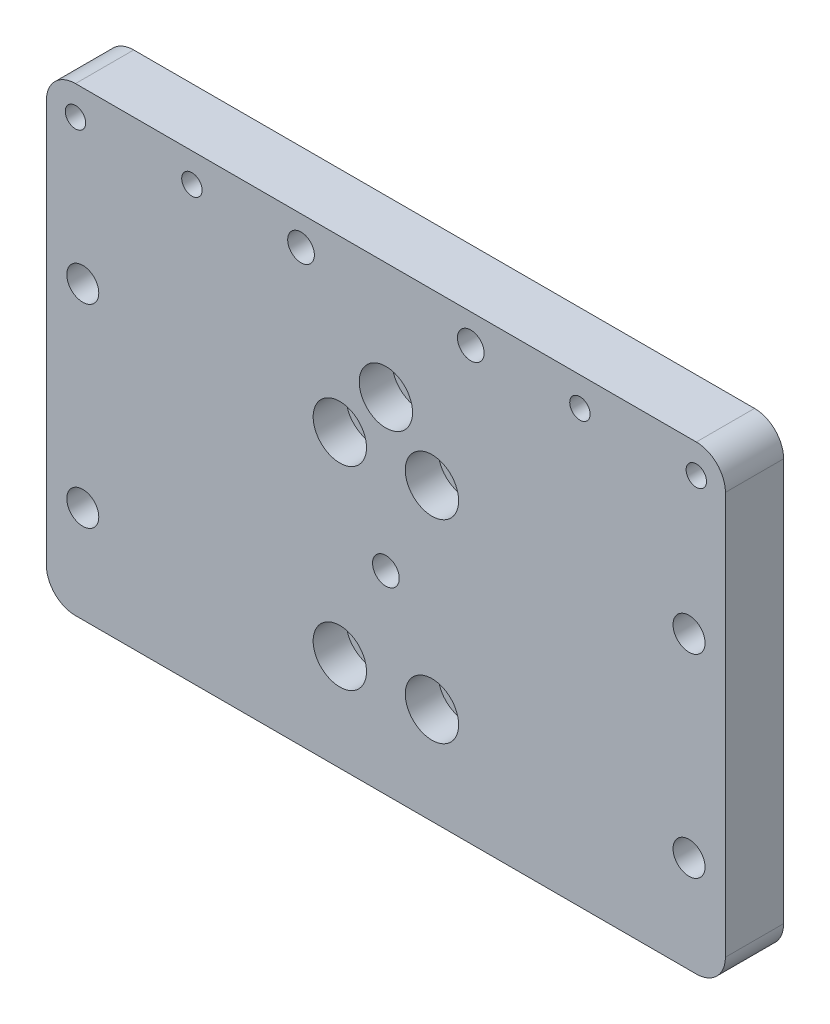
from build123d import *

# Parameters (mm, degrees)
SKETCH1_W           = 140
SKETCH1_H           = 95
BOSS_EXTRUDE1_DEPTH = 6
SKETCH2_R           = 2.75
SKETCH2_R_2         = 3.3
SKETCH2_R_3         = 2.1
CUT_EXTRUDE1_DEPTH  = 86.441500455
SKETCH3_R           = 5.5
CUT_EXTRUDE2_DEPTH  = 6.8
FILLET1_R           = 6


with BuildPart() as part:
    # Sketch1 → Boss-Extrude1 (new, symmetric)
    with BuildSketch(Plane.XY):
        Rectangle(SKETCH1_W, SKETCH1_H)
    extrude(amount=BOSS_EXTRUDE1_DEPTH, both=True)

    # Sketch2 → Cut-Extrude1 (cut, through all)
    with BuildSketch(Plane.XY.offset(6)):
        with Locations((0, 23.5)):
            Circle(SKETCH2_R)
        with Locations((0, -7.5)):
            Circle(SKETCH2_R)
        with Locations((-9.5, 12.5)):
            Circle(SKETCH2_R_2)
        with Locations((-9.5, -27.5)):
            Circle(SKETCH2_R_2)
        with Locations((-17.5, 41.5)):
            Circle(SKETCH2_R)
        with Locations((-40, 41.5)):
            Circle(SKETCH2_R_3)
        with Locations((-64, 41.5)):
            Circle(SKETCH2_R_3)
        with Locations((-62.5, 12.5)):
            Circle(SKETCH2_R_2)
        with Locations((-62.5, -27.5)):
            Circle(SKETCH2_R_2)
        with Locations(Location((62.5, -27.5, 0), (0, 0, 180))):
            Circle(SKETCH2_R_2)
        with Locations(Location((62.5, 12.5, 0), (0, 0, 180))):
            Circle(SKETCH2_R_2)
        with Locations(Location((64, 41.5, 0), (0, 0, 180))):
            Circle(SKETCH2_R_3)
        with Locations(Location((40, 41.5, 0), (0, 0, 180))):
            Circle(SKETCH2_R_3)
        with Locations(Location((17.5, 41.5, 0), (0, 0, 180))):
            Circle(SKETCH2_R)
        with Locations(Location((9.5, -27.5, 0), (0, 0, 180))):
            Circle(SKETCH2_R_2)
        with Locations(Location((9.5, 12.5, 0), (0, 0, 180))):
            Circle(SKETCH2_R_2)
    extrude(amount=-CUT_EXTRUDE1_DEPTH, mode=Mode.SUBTRACT)

    # Sketch3 → Cut-Extrude2 (cut)
    with BuildSketch(Plane.XY.offset(6)):
        with Locations((-9.5, -27.5)):
            Circle(SKETCH3_R)
        with Locations((9.5, -27.5)):
            Circle(SKETCH3_R)
        with Locations((9.5, 12.5)):
            Circle(SKETCH3_R)
        with Locations((0, 23.5)):
            Circle(SKETCH3_R)
        with Locations((-9.5, 12.5)):
            Circle(SKETCH3_R)
    extrude(amount=-CUT_EXTRUDE2_DEPTH, mode=Mode.SUBTRACT)

    # Fillet1
    fillet1_edges = [part.edges().sort_by_distance(p)[0] for p in [
        (-70, 47.5, 0),
        (70, 47.5, 0),
        (70, -47.5, 0),
        (-70, -47.5, 0),
    ]]
    fillet(fillet1_edges, radius=FILLET1_R)


solid = part.part
